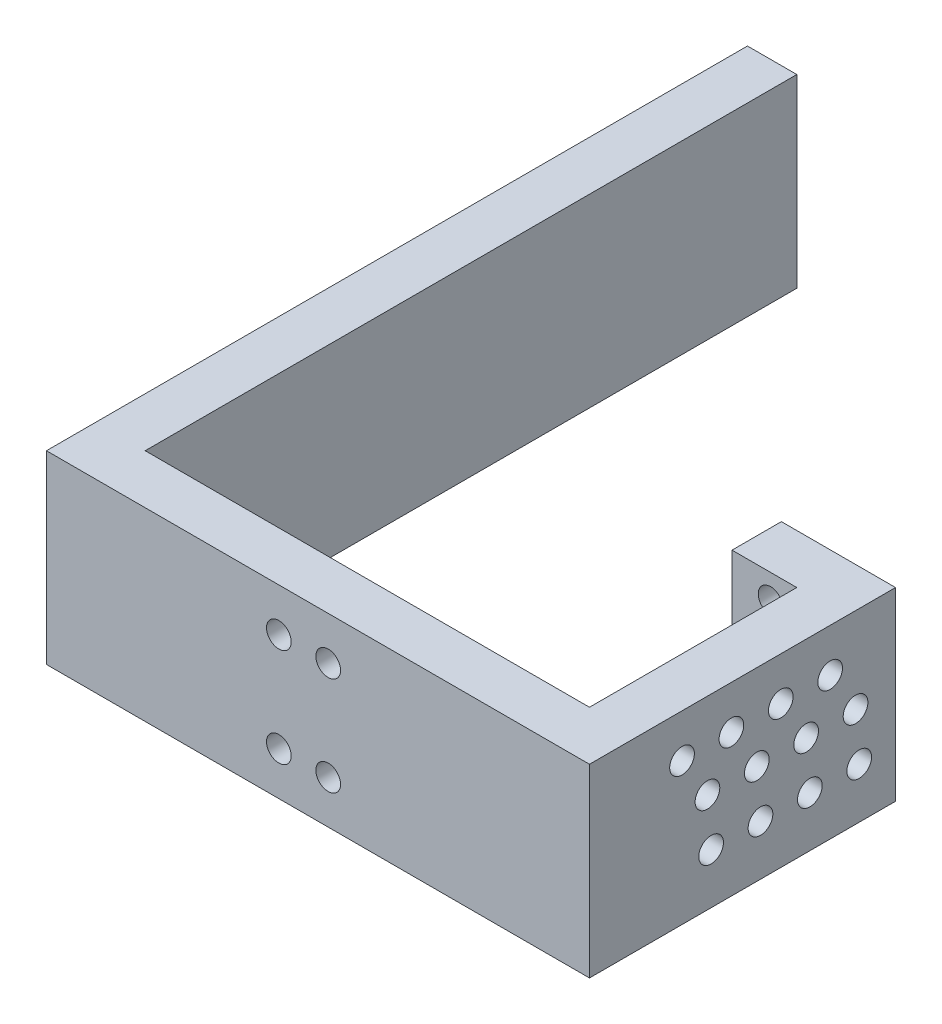
from build123d import *

# Parameters (mm, degrees)
SKETCH_1_W          = 72
SKETCH_1_H          = 30
EXTRUDE_1_DEPTH     = 8
SKETCH_2_W          = 113.6
SKETCH_2_H          = 30
EXTRUDE_2_DEPTH     = 8
SKETCH_3_W          = 49.6
SKETCH_3_H          = 30
EXTRUDE_3_DEPTH     = 8
SKETCH_5_W          = 18.5
SKETCH_5_H          = 30
SKETCH_5_R          = 2
EXTRUDE_4_DEPTH     = 8
SKETCH_10_R         = 2
CUT_EXTRUDE_3_DEPTH = 15.5
SKETCH_11_R         = 2
CUT_EXTRUDE_4_DEPTH = 6
SKETCH_12_R         = 1.8
CUT_EXTRUDE_6_DEPTH = 8
CUT_EXTRUDE_START   = -6
SKETCH_13_R         = 2
CUT_EXTRUDE_7_DEPTH = 6


with BuildPart() as part:
    # 草圖1 → 填料-伸長1 (new body)
    with BuildSketch(Plane.XY):
        with Locations((36, 15)):
            Rectangle(SKETCH_1_W, SKETCH_1_H)
    extrude(amount=EXTRUDE_1_DEPTH)

    # 草圖2 → 填料-伸長2 (add)
    with BuildSketch(Plane.ZY):
        with Locations((-48.8, 15)):
            Rectangle(SKETCH_2_W, SKETCH_2_H)
    extrude(amount=EXTRUDE_2_DEPTH)

    # 草圖3 → 填料-伸長3 (add)
    with BuildSketch(Plane(origin=(72, 0, 0), x_dir=(0, 0, -1), z_dir=(1, 0, 0))):
        with Locations((16.8, 15)):
            Rectangle(SKETCH_3_W, SKETCH_3_H)
    extrude(amount=EXTRUDE_3_DEPTH)

    # 草圖5 → 填料-伸長4 (add)
    with BuildSketch(Plane(origin=(0, 0, -41.6), x_dir=(-1, 0, 0), z_dir=(0, 0, -1))):
        with Locations((-70.75, 15)):
            Rectangle(SKETCH_5_W, SKETCH_5_H)
        with Locations(Location((-67.75, 26, 0), (0, 0, 90))):
            Circle(SKETCH_5_R, mode=Mode.SUBTRACT)
        with Locations(Location((-67.75, 18, 0), (0, 0, 90))):
            Circle(SKETCH_5_R, mode=Mode.SUBTRACT)
        with Locations(Location((-67.75, 10, 0), (0, 0, 90))):
            Circle(SKETCH_5_R, mode=Mode.SUBTRACT)
    extrude(amount=-EXTRUDE_4_DEPTH)

    # 草圖10 → 除料-伸長3 (cut)
    with BuildSketch(Plane.XY.offset(8)):
        with Locations((29.66, 23)):
            Circle(SKETCH_10_R)
        with Locations((37.66, 23)):
            Circle(SKETCH_10_R)
        with Locations((37.66, 7)):
            Circle(SKETCH_10_R)
        with Locations((29.66, 7)):
            Circle(SKETCH_10_R)
    extrude(amount=-CUT_EXTRUDE_3_DEPTH, mode=Mode.SUBTRACT)

    # 草圖11 → 除料-伸長4 (cut)
    with BuildSketch(Plane.ZY.offset(8)):
        with Locations((-31, 23)):
            Circle(SKETCH_11_R)
        with Locations((-31, 15)):
            Circle(SKETCH_11_R)
        with Locations((-31, 7)):
            Circle(SKETCH_11_R)
        with Locations((-23, 23)):
            Circle(SKETCH_11_R)
        with Locations((-23, 15)):
            Circle(SKETCH_11_R)
        with Locations((-23, 7)):
            Circle(SKETCH_11_R)
        with Locations((-15, 23)):
            Circle(SKETCH_11_R)
        with Locations((-15, 15)):
            Circle(SKETCH_11_R)
        with Locations((-15, 7)):
            Circle(SKETCH_11_R)
        with Locations((-7, 23)):
            Circle(SKETCH_11_R)
        with Locations((-7, 15)):
            Circle(SKETCH_11_R)
        with Locations((-7, 7)):
            Circle(SKETCH_11_R)
    extrude(amount=-CUT_EXTRUDE_4_DEPTH, mode=Mode.SUBTRACT)

    # 草圖12 → 除料-伸長6 (cut)
    with BuildSketch(Plane(origin=(0, 0, -105.6), x_dir=(-1, 0, 0), z_dir=(0, 0, -1))):
        with Locations((3, 23)):
            Circle(SKETCH_12_R)
        with Locations((3, 15)):
            Circle(SKETCH_12_R)
        with Locations((3, 7)):
            Circle(SKETCH_12_R)
    extrude(amount=-CUT_EXTRUDE_6_DEPTH, mode=Mode.SUBTRACT)

    # 草圖13 → 除料-伸長7 (cut)
    with BuildSketch(Plane(origin=(80, 0, 0), x_dir=(0, 0, -1), z_dir=(1, 0, 0)).offset(CUT_EXTRUDE_START)):
        with Locations(Location((7, 23, 0), (0, 0, 180))):
            Circle(SKETCH_13_R)
        with Locations((11.115966043, 16.140056594)):
            Circle(SKETCH_13_R)
        with Locations((11.713009493, 8.162366508)):
            Circle(SKETCH_13_R)
        with Locations(Location((15, 23, 0), (0, 0, 180))):
            Circle(SKETCH_13_R)
        with Locations((19.115966043, 16.140056594)):
            Circle(SKETCH_13_R)
        with Locations((19.713009493, 8.162366508)):
            Circle(SKETCH_13_R)
        with Locations(Location((23, 23, 0), (0, 0, 180))):
            Circle(SKETCH_13_R)
        with Locations((27.115966043, 16.140056594)):
            Circle(SKETCH_13_R)
        with Locations((27.713009493, 8.162366508)):
            Circle(SKETCH_13_R)
        with Locations(Location((31, 23, 0), (0, 0, 180))):
            Circle(SKETCH_13_R)
        with Locations((35.115966043, 16.140056594)):
            Circle(SKETCH_13_R)
        with Locations((35.713009493, 8.162366508)):
            Circle(SKETCH_13_R)
    extrude(amount=CUT_EXTRUDE_7_DEPTH, mode=Mode.SUBTRACT)


solid = part.part
